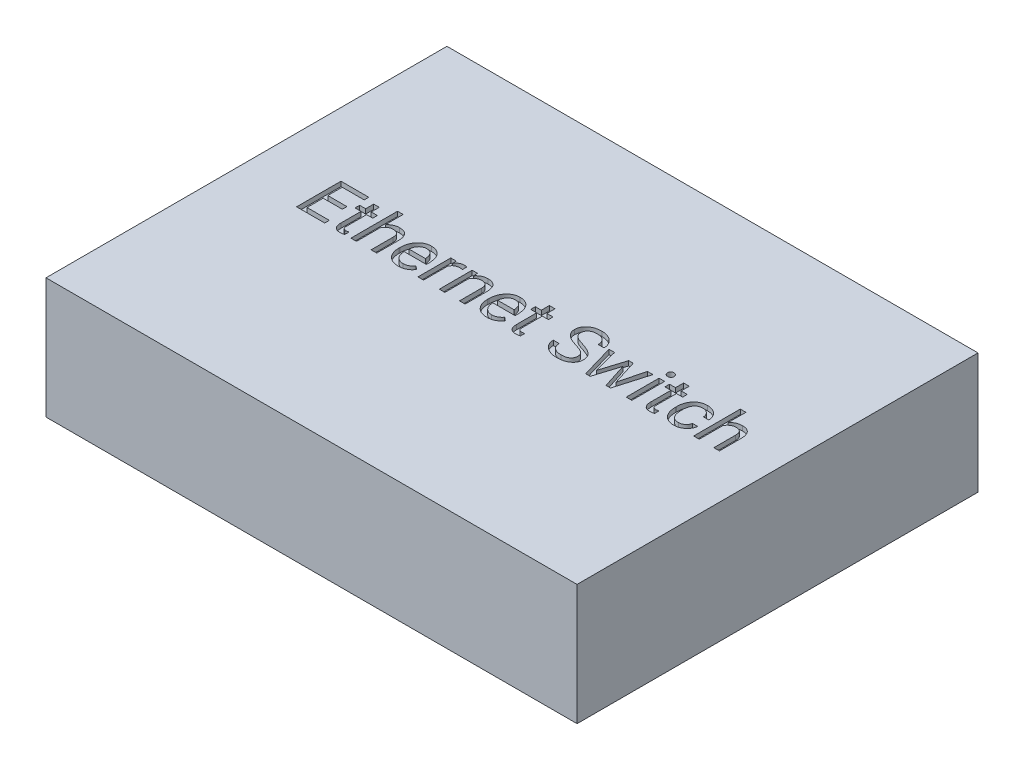
from build123d import *

# Parameters (mm, degrees)
SKETCH1_W           = 114.046
SKETCH1_H           = 86.106
BOSS_EXTRUDE1_DEPTH = 12.954
SKETCH2_W           = 1.206087662
SKETCH2_H           = 7.050974026
CUT_EXTRUDE1_DEPTH  = 1


with BuildPart() as part:
    # Sketch1 → Boss-Extrude1 (new, symmetric)
    with BuildSketch(Plane(origin=(0, 0, 0), x_dir=(1, 0, 0), z_dir=(0, 1, 0))):
        with Locations((57.023, 43.053)):
            Rectangle(SKETCH1_W, SKETCH1_H)
    extrude(amount=BOSS_EXTRUDE1_DEPTH, both=True)

    # Sketch2 → Cut-Extrude1 (cut)
    # profile 1 of 15: a face of its own
    with BuildSketch(Plane(origin=(0, 12.954, 0), x_dir=(1, 0, 0), z_dir=(0, 1, 0))):
        with BuildLine():
            add(Edge.make_bspline(
                [(84.393738457, 49.07515614), (84.395988724, 49.121740429), (84.400361707, 49.212268465), (84.433798421, 49.342484863), (84.490920099, 49.460792959), (84.570685999, 49.565566641), (84.67164016, 49.654939388), (84.798377615, 49.717091756), (84.944798541, 49.755933377), (85.105624155, 49.764005142), (85.266065985, 49.756460845), (85.412535753, 49.716169796), (85.540179197, 49.655699643), (85.640988395, 49.564830263), (85.723956021, 49.461189062), (85.779196726, 49.340555973), (85.815320997, 49.210744244), (85.825656935, 49.073838563), (85.814999137, 48.937099075), (85.780081634, 48.808668286), (85.723142246, 48.690751535), (85.64160492, 48.589102027), (85.539232867, 48.502528449), (85.412460966, 48.44355678), (85.26574728, 48.40611134), (85.105626878, 48.397554977), (84.945101759, 48.406621943), (84.798485283, 48.442663112), (84.672523827, 48.50325127), (84.570234336, 48.588438838), (84.4904732, 48.691827656), (84.434248468, 48.809247128), (84.400107229, 48.938610746), (84.395912159, 49.028552342), (84.393738457, 49.07515614)],
                knots=[0, 0, 0, 0, 1.003253555, 1.949639571, 2.87501048, 3.816493968, 4.771398848, 5.752595909, 6.830435126, 8.01367739, 9.210771534, 10.275199678, 11.268797055, 12.223701935, 13.173646762, 14.111539333, 15.061484161, 16.064737715, 17.054153962, 18.004098789, 18.916987501, 19.856010126, 20.792977095, 21.780442597, 22.841332467, 24.03842661, 25.221668875, 26.296013986, 27.271001189, 28.207968158, 29.138430125, 30.063801034, 30.996746445, 32, 32, 32, 32], degree=3))
        make_face()
    # profile 2 of 15: a face of its own
    with BuildSketch(Plane(origin=(0, 12.954, 0), x_dir=(1, 0, 0), z_dir=(0, 1, 0))):
        Polygon((19.075587077, 44.565857236), (14.958653229, 44.565857236), (14.958653229, 41.102220872), (19.740481557, 41.102220872), (19.740481557, 40.112610483), (13.70617758, 40.112610483), (13.70617758, 49.637610483), (19.676698075, 49.637610483), (19.676698075, 48.648000093), (14.958653229, 48.648000093), (14.958653229, 45.555467626), (19.075587077, 45.555467626), align=None)
    # profile 3 of 15: a face of its own
    with BuildSketch(Plane(origin=(0, 12.954, 0), x_dir=(1, 0, 0), z_dir=(0, 1, 0))):
        with BuildLine():
            Line((22.6841859, 48.89540269), (22.6841859, 47.163584509))
            Line((22.6841859, 47.163584509), (24.000445031, 47.163584509))
            Line((24.000445031, 47.163584509), (24.000445031, 46.173974119))
            Line((24.000445031, 46.173974119), (22.6841859, 46.173974119))
            Line((22.6841859, 46.173974119), (22.6841859, 41.821234671))
            add(Edge.make_bspline(
                [(22.6841859, 41.821234671), (22.68627404, 41.755360583), (22.690213925, 41.631069941), (22.722657013, 41.457550969), (22.77557331, 41.308820061), (22.854843152, 41.185400753), (22.963228171, 41.089025748), (23.102844259, 41.022426812), (23.271815776, 40.985564598), (23.393991216, 40.980972478), (23.45925185, 40.978519574)],
                knots=[0, 0, 0, 0, 1.194179343, 2.253166964, 3.188819159, 4.041361455, 4.885773766, 5.78479529, 6.816737128, 8, 8, 8, 8], degree=3))
            add(Edge.make_bspline(
                [(23.45925185, 40.978519574), (23.497284534, 40.9801046), (23.579966739, 40.983550413), (23.714358116, 40.997214254), (23.86746733, 41.023459183), (23.976009657, 41.044648309), (24.033303189, 41.055832885)],
                knots=[0, 0, 0, 0, 0.787449865, 1.711898398, 2.792236841, 4, 4, 4, 4], degree=3))
            Line((24.033303189, 41.055832885), (24.033303189, 40.114543315))
            add(Edge.make_bspline(
                [(24.033303189, 40.114543315), (23.954882378, 40.095672023), (23.799521243, 40.058285703), (23.566067845, 40.017380525), (23.335407413, 39.99361694), (23.182908819, 39.99046719), (23.107476281, 39.988909184)],
                knots=[0, 0, 0, 0, 1.033085524, 2.046667695, 3.033795592, 4, 4, 4, 4], degree=3))
            add(Edge.make_bspline(
                [(23.107476281, 39.988909184), (23.042314742, 39.990235056), (22.915424007, 39.992816961), (22.731354767, 40.017408187), (22.558314945, 40.052019039), (22.399425611, 40.107261752), (22.252016041, 40.17533966), (22.11715207, 40.258400311), (21.992825884, 40.355407811), (21.885326847, 40.471243954), (21.787621229, 40.598762886), (21.705290049, 40.741166885), (21.633166638, 40.894067772), (21.574915616, 41.059850796), (21.531287973, 41.238703617), (21.498402199, 41.4297977), (21.478822555, 41.633984069), (21.477068766, 41.774158768), (21.476165405, 41.846361497)],
                knots=[0, 0, 0, 0, 1.108571827, 2.158750336, 3.156840449, 4.107148202, 5.014858842, 5.91585275, 6.797958628, 7.690098004, 8.598206094, 9.527394683, 10.484135866, 11.472720431, 12.512770955, 13.614431317, 14.77121499, 16, 16, 16, 16], degree=3))
            Line((21.476165405, 41.846361497), (21.476165405, 46.173974119))
            Line((21.476165405, 46.173974119), (20.190831598, 46.173974119))
            Line((20.190831598, 46.173974119), (20.190831598, 47.163584509))
            Line((20.190831598, 47.163584509), (21.476165405, 47.163584509))
            Line((21.476165405, 47.163584509), (21.476165405, 48.89540269))
            Line((21.476165405, 48.89540269), (22.6841859, 48.89540269))
        make_face()
    # profile 4 of 15: a face of its own
    with BuildSketch(Plane(origin=(0, 12.954, 0), x_dir=(1, 0, 0), z_dir=(0, 1, 0))):
        with BuildLine():
            add(Edge.make_bspline(
                [(26.569179812, 46.303473916), (26.637266202, 46.381552348), (26.771045186, 46.534964112), (26.994242002, 46.737462888), (27.234859891, 46.90720166), (27.489474463, 47.046734104), (27.760426798, 47.154107596), (28.045590078, 47.231292682), (28.346446779, 47.278760581), (28.552092192, 47.284412471), (28.656639228, 47.287285807)],
                knots=[0, 0, 0, 0, 1.039536542, 2.042524824, 3.017095615, 3.989732349, 4.950704766, 5.936184754, 6.950787365, 8, 8, 8, 8], degree=3))
            add(Edge.make_bspline(
                [(28.656639228, 47.287285807), (28.746902767, 47.285449189), (28.922765086, 47.281870867), (29.177927682, 47.253680527), (29.414929915, 47.202476573), (29.635881191, 47.135746675), (29.83899786, 47.046938531), (30.025383708, 46.937439961), (30.193374168, 46.808011662), (30.344537648, 46.65867744), (30.477803063, 46.490701762), (30.592602149, 46.301928675), (30.69168797, 46.095139672), (30.769984111, 45.8663383), (30.833413859, 45.619505221), (30.88018299, 45.352705528), (30.906061713, 45.066316591), (30.91142411, 44.868716431), (30.914187929, 44.766871846)],
                knots=[0, 0, 0, 0, 1.11894567, 2.180064983, 3.176408189, 4.121284808, 5.036911353, 5.917734688, 6.794819938, 7.658971414, 8.545893982, 9.445919302, 10.392684596, 11.382926046, 12.438741236, 13.549675942, 14.737084854, 16, 16, 16, 16], degree=3))
            Line((30.914187929, 44.766871846), (30.914187929, 40.112610483))
            Line((30.914187929, 40.112610483), (29.706167434, 40.112610483))
            Line((29.706167434, 40.112610483), (29.706167434, 44.799730004))
            add(Edge.make_bspline(
                [(29.706167434, 44.799730004), (29.705111693, 44.861616427), (29.703072681, 44.98114119), (29.685828782, 45.154429803), (29.655867875, 45.314118785), (29.621294843, 45.463397847), (29.569170836, 45.598065209), (29.512727636, 45.723136415), (29.442787733, 45.834646539), (29.359628056, 45.931460503), (29.269402597, 46.020774755), (29.162702926, 46.093470757), (29.047035165, 46.157246784), (28.91929947, 46.211277787), (28.778254926, 46.247391798), (28.626752179, 46.277303222), (28.463107985, 46.294617935), (28.350002752, 46.296631144), (28.29133383, 46.297675418)],
                knots=[0, 0, 0, 0, 1.252582418, 2.419183561, 3.51915157, 4.540799327, 5.51463237, 6.436427351, 7.315632186, 8.167224478, 9.015815731, 9.87694107, 10.769965296, 11.68787746, 12.674980604, 13.710846149, 14.812590855, 16, 16, 16, 16], degree=3))
            add(Edge.make_bspline(
                [(28.29133383, 46.297675418), (28.196277139, 46.294331714), (28.009970617, 46.287778216), (27.740106224, 46.225206799), (27.487512365, 46.126310773), (27.255846554, 45.988148794), (27.046709577, 45.81855701), (26.859915991, 45.624180049), (26.696937307, 45.4043455), (26.612156417, 45.241689485), (26.569179812, 45.159236903)],
                knots=[0, 0, 0, 0, 1.044429403, 2.047031152, 3.030327181, 4.018694736, 5.001760782, 5.984392266, 6.978260582, 8, 8, 8, 8], degree=3))
            Line((26.569179812, 45.159236903), (26.569179812, 40.112610483))
            Line((26.569179812, 40.112610483), (25.36309215, 40.112610483))
            Line((25.36309215, 40.112610483), (25.36309215, 50.132415677))
            Line((25.36309215, 50.132415677), (26.569179812, 50.132415677))
            Line((26.569179812, 50.132415677), (26.569179812, 46.303473916))
        make_face()
    # profile 5 of 15: a face of its own
    with BuildSketch(Plane(origin=(0, 12.954, 0), x_dir=(1, 0, 0), z_dir=(0, 1, 0))):
        with BuildLine():
            add(Edge.make_bspline(
                [(35.607105949, 39.988909184), (35.490371734, 39.992122999), (35.261273976, 39.9984303), (34.925752241, 40.040760355), (34.606285582, 40.114096294), (34.304345584, 40.219292497), (34.018165026, 40.350822257), (33.749157983, 40.512030007), (33.499119498, 40.705622395), (33.26566094, 40.924773826), (33.055416882, 41.169532548), (32.872890249, 41.436356918), (32.717091624, 41.722451839), (32.589901716, 42.028253975), (32.490365629, 42.353803057), (32.422308385, 42.699676737), (32.378367214, 43.064844767), (32.37384874, 43.315183156), (32.371543854, 43.442881384)],
                knots=[0, 0, 0, 0, 1.051225119, 2.063091096, 3.039863284, 3.997702364, 4.937463199, 5.871835042, 6.815332018, 7.779913259, 8.750981872, 9.715004522, 10.6860558, 11.679572897, 12.692718992, 13.746423136, 14.850444908, 16, 16, 16, 16], degree=3))
            Line((32.371543854, 43.442881384), (32.371543854, 43.663224322))
            add(Edge.make_bspline(
                [(32.371543854, 43.663224322), (32.372436703, 43.749600315), (32.37419809, 43.920000415), (32.394780372, 44.171511771), (32.424815918, 44.416223759), (32.469645354, 44.653554963), (32.525956632, 44.884465908), (32.5929037, 45.108877647), (32.674242615, 45.325870134), (32.769347882, 45.534662782), (32.874806734, 45.733937698), (32.989377379, 45.923733712), (33.115646367, 46.101225663), (33.249938694, 46.269511653), (33.395803938, 46.425510863), (33.553294622, 46.567429254), (33.717470408, 46.702637066), (33.892726375, 46.822946601), (34.074254814, 46.931239544), (34.260248972, 47.026044936), (34.450165964, 47.108379844), (34.644421462, 47.173187068), (34.842086935, 47.224080471), (35.042864503, 47.261028904), (35.248425404, 47.282375134), (35.386715287, 47.285641284), (35.456344991, 47.287285807)],
                knots=[0, 0, 0, 0, 1.170389505, 2.308911091, 3.417986088, 4.510645856, 5.58017196, 6.638193788, 7.682688568, 8.718275774, 9.745583472, 10.73697058, 11.720597728, 12.695660602, 13.65320595, 14.611228956, 15.567220266, 16.533682422, 17.489115256, 18.430275997, 19.361295633, 20.291864719, 21.202556407, 22.125721625, 23.056290712, 24, 24, 24, 24], degree=3))
            add(Edge.make_bspline(
                [(35.456344991, 47.287285807), (35.567957701, 47.285023833), (35.785598283, 47.280613069), (36.102008556, 47.236568236), (36.40031307, 47.167911356), (36.679153276, 47.069338231), (36.939396011, 46.942534996), (37.179735391, 46.787754755), (37.400514429, 46.603541315), (37.601080559, 46.392496935), (37.782184124, 46.156225927), (37.936233512, 45.893083768), (38.068515751, 45.607922605), (38.174341052, 45.297992855), (38.257233146, 44.964267417), (38.315911586, 44.60617468), (38.353898775, 44.223919435), (38.357569651, 43.960976065), (38.359459845, 43.825582276)],
                knots=[0, 0, 0, 0, 1.043722712, 2.035219983, 2.982713475, 3.903600427, 4.795969756, 5.68552487, 6.571580403, 7.479752251, 8.404498235, 9.350456392, 10.326811463, 11.341010182, 12.409761646, 13.540517269, 14.733572618, 16, 16, 16, 16], degree=3))
            Line((38.359459845, 43.825582276), (38.359459845, 43.328844249))
            Line((38.359459845, 43.328844249), (33.577631517, 43.328844249))
            add(Edge.make_bspline(
                [(33.577631517, 43.328844249), (33.581442473, 43.24304779), (33.588889949, 43.075381981), (33.622496254, 42.830465636), (33.672421088, 42.597687357), (33.739791408, 42.376955342), (33.824870146, 42.169041152), (33.928261899, 41.974476716), (34.047936127, 41.792040095), (34.1854903, 41.624489061), (34.334886537, 41.472266987), (34.496221832, 41.338985689), (34.669237794, 41.229450271), (34.850662983, 41.136978166), (35.041932468, 41.065513382), (35.243623125, 41.015472241), (35.454661658, 40.983295223), (35.599255015, 40.980129999), (35.672822264, 40.978519574)],
                knots=[0, 0, 0, 0, 1.170963297, 2.288328803, 3.36740092, 4.415427927, 5.432183575, 6.42682151, 7.416438249, 8.403319616, 9.37898494, 10.321963152, 11.250788358, 12.166549739, 13.095374945, 14.028969237, 14.997164786, 16, 16, 16, 16], degree=3))
            add(Edge.make_bspline(
                [(35.672822264, 40.978519574), (35.775464773, 40.981113263), (35.973608591, 40.98612019), (36.258386953, 41.035016505), (36.518569344, 41.1162255), (36.755114406, 41.230012174), (36.971342179, 41.372353857), (37.173612874, 41.534382009), (37.363461036, 41.716890334), (37.475518762, 41.852924127), (37.53220741, 41.921741976)],
                knots=[0, 0, 0, 0, 1.136012797, 2.192989183, 3.18823502, 4.145723679, 5.089823975, 6.04933131, 7.013180329, 8, 8, 8, 8], degree=3))
            Line((37.53220741, 41.921741976), (38.268616703, 41.34962347))
            add(Edge.make_bspline(
                [(38.268616703, 41.34962347), (38.192705828, 41.241193859), (38.04379167, 41.028487785), (37.777296557, 40.749841915), (37.483553483, 40.513855009), (37.161595234, 40.320892916), (36.811862139, 40.170715587), (36.434222669, 40.065437283), (36.029434905, 40.000202695), (35.75039007, 39.992740749), (35.607105949, 39.988909184)],
                knots=[0, 0, 0, 0, 1.014704253, 1.990542579, 2.947365425, 3.898858026, 4.862403721, 5.859509066, 6.90089934, 8, 8, 8, 8], degree=3))
        make_face()
        with BuildLine():
            add(Edge.make_bspline(
                [(35.456344991, 46.297675418), (35.396326335, 46.29645875), (35.278952509, 46.294079407), (35.106839203, 46.267439463), (34.941896216, 46.226803962), (34.782903497, 46.171900905), (34.633043129, 46.096350715), (34.488878379, 46.00796779), (34.353810787, 45.900475538), (34.225636698, 45.778820933), (34.108821195, 45.641474279), (34.001004675, 45.492463416), (33.909124497, 45.32798298), (33.824731803, 45.152560452), (33.756629295, 44.961429378), (33.695940545, 44.759274632), (33.649698406, 44.54327722), (33.628886216, 44.394629292), (33.618221005, 44.318454638)],
                knots=[0, 0, 0, 0, 0.965700087, 1.888544676, 2.796872033, 3.699195918, 4.589995704, 5.493928382, 6.417472449, 7.364036721, 8.335127011, 9.316799301, 10.320480783, 11.364630344, 12.447737028, 13.5835194, 14.761674146, 16, 16, 16, 16], degree=3))
            Line((33.618221005, 44.318454638), (37.153372182, 44.318454638))
            Line((37.153372182, 44.318454638), (37.153372182, 44.407364947))
            add(Edge.make_bspline(
                [(37.153372182, 44.407364947), (37.147786614, 44.480250775), (37.136874069, 44.62264806), (37.106548955, 44.8295911), (37.06143774, 45.023778498), (37.006473196, 45.205135887), (36.937845505, 45.373968697), (36.85719385, 45.530046704), (36.764184403, 45.673949081), (36.659348795, 45.804261254), (36.543445158, 45.920379378), (36.417102448, 46.021632807), (36.280918436, 46.107233469), (36.134984271, 46.177147125), (35.979367828, 46.231405671), (35.813534665, 46.269999168), (35.638056952, 46.293384138), (35.517623782, 46.296228268), (35.456344991, 46.297675418)],
                knots=[0, 0, 0, 0, 1.231488959, 2.405964106, 3.519878164, 4.587773015, 5.59571827, 6.586208607, 7.543728754, 8.477887434, 9.399024737, 10.302660484, 11.200211513, 12.103325454, 13.023438702, 13.971372583, 14.967794054, 16, 16, 16, 16], degree=3))
        make_face(mode=Mode.SUBTRACT)
    # profile 6 of 15: a face of its own
    with BuildSketch(Plane(origin=(0, 12.954, 0), x_dir=(1, 0, 0), z_dir=(0, 1, 0))):
        with BuildLine():
            add(Edge.make_bspline(
                [(43.181877661, 46.253220263), (43.086659658, 46.265945993), (42.889742539, 46.292263643), (42.691092228, 46.295832341), (42.588497994, 46.297675418)],
                knots=[0, 0, 0, 0, 0.967087096, 2, 2, 2, 2], degree=3))
            add(Edge.make_bspline(
                [(42.588497994, 46.297675418), (42.492880397, 46.295348664), (42.308570696, 46.290863681), (42.044702115, 46.238483759), (41.804686481, 46.158182091), (41.587292265, 46.045037567), (41.396615451, 45.895462575), (41.2281327, 45.715596588), (41.085174399, 45.501703886), (41.013510501, 45.342124091), (40.976515445, 45.259744208)],
                knots=[0, 0, 0, 0, 1.117396154, 2.153860347, 3.133723222, 4.071226581, 5.006180228, 5.955611437, 6.944625228, 8, 8, 8, 8], degree=3))
            Line((40.976515445, 45.259744208), (40.976515445, 40.112610483))
            Line((40.976515445, 40.112610483), (39.770427783, 40.112610483))
            Line((39.770427783, 40.112610483), (39.770427783, 47.163584509))
            Line((39.770427783, 47.163584509), (40.943657288, 47.163584509))
            Line((40.943657288, 47.163584509), (40.962985616, 46.344063405))
            add(Edge.make_bspline(
                [(40.962985616, 46.344063405), (41.013565146, 46.41870515), (41.112562447, 46.564798468), (41.284489478, 46.758540477), (41.473313774, 46.921692603), (41.676577877, 47.056692623), (41.898182409, 47.158767593), (42.133095097, 47.236123727), (42.385377467, 47.277703389), (42.558079813, 47.284041463), (42.646482978, 47.287285807)],
                knots=[0, 0, 0, 0, 1.069262689, 2.092825304, 3.063142347, 4.023801543, 4.978110818, 5.950143453, 6.950716006, 8, 8, 8, 8], degree=3))
            add(Edge.make_bspline(
                [(42.646482978, 47.287285807), (42.701971193, 47.287156541), (42.805470302, 47.286915427), (42.949792333, 47.2695661), (43.074806639, 47.25013448), (43.148030089, 47.222668607), (43.181877661, 47.209972496)],
                knots=[0, 0, 0, 0, 1.222168938, 2.279644317, 3.204764829, 4, 4, 4, 4], degree=3))
            Line((43.181877661, 47.209972496), (43.181877661, 46.253220263))
        make_face()
    # profile 7 of 15: a face of its own
    with BuildSketch(Plane(origin=(0, 12.954, 0), x_dir=(1, 0, 0), z_dir=(0, 1, 0))):
        with BuildLine():
            Line((45.487747182, 47.163584509), (45.526403838, 46.272548591))
            add(Edge.make_bspline(
                [(45.526403838, 46.272548591), (45.594922769, 46.353394927), (45.729543556, 46.512235661), (45.9571971, 46.719124367), (46.199056118, 46.895757445), (46.457237245, 47.039633471), (46.732193994, 47.150264391), (47.021505035, 47.228928007), (47.326032769, 47.279545867), (47.534411377, 47.284667774), (47.640922913, 47.287285807)],
                knots=[0, 0, 0, 0, 1.045030138, 2.05319576, 3.027464063, 3.995257506, 4.962319553, 5.944976367, 6.949586405, 8, 8, 8, 8], degree=3))
            add(Edge.make_bspline(
                [(47.640922913, 47.287285807), (47.731186452, 47.285449189), (47.907048771, 47.281870867), (48.162211367, 47.253680527), (48.3992136, 47.202476573), (48.620164876, 47.135746675), (48.823281545, 47.046938531), (49.009667393, 46.937439961), (49.177657853, 46.808011662), (49.328821333, 46.65867744), (49.462086748, 46.490701762), (49.576885834, 46.301928675), (49.675971655, 46.095139672), (49.754267796, 45.8663383), (49.817697544, 45.619505221), (49.864466675, 45.352705528), (49.890345398, 45.066316591), (49.895707795, 44.868716431), (49.898471614, 44.766871846)],
                knots=[0, 0, 0, 0, 1.11894567, 2.180064983, 3.176408189, 4.121284808, 5.036911353, 5.917734688, 6.794819938, 7.658971414, 8.545893982, 9.445919302, 10.392684596, 11.382926046, 12.438741236, 13.549675942, 14.737084854, 16, 16, 16, 16], degree=3))
            Line((49.898471614, 44.766871846), (49.898471614, 40.112610483))
            Line((49.898471614, 40.112610483), (48.690451119, 40.112610483))
            Line((48.690451119, 40.112610483), (48.690451119, 44.799730004))
            add(Edge.make_bspline(
                [(48.690451119, 44.799730004), (48.689395378, 44.861616427), (48.687356367, 44.98114119), (48.670112467, 45.154429803), (48.64015156, 45.314118785), (48.605578528, 45.463397847), (48.553454522, 45.598065209), (48.497011321, 45.723136415), (48.427071418, 45.834646539), (48.343911741, 45.931460503), (48.253686283, 46.020774755), (48.146986611, 46.093470757), (48.03131885, 46.157246784), (47.903583155, 46.211277787), (47.762538611, 46.247391798), (47.611035864, 46.277303222), (47.447391671, 46.294617935), (47.334286437, 46.296631144), (47.275617515, 46.297675418)],
                knots=[0, 0, 0, 0, 1.252582418, 2.419183561, 3.51915157, 4.540799327, 5.51463237, 6.436427351, 7.315632186, 8.167224478, 9.015815731, 9.87694107, 10.769965296, 11.68787746, 12.674980604, 13.710846149, 14.812590855, 16, 16, 16, 16], degree=3))
            add(Edge.make_bspline(
                [(47.275617515, 46.297675418), (47.180560824, 46.294331714), (46.994254302, 46.287778216), (46.724389909, 46.225206799), (46.47179605, 46.126310773), (46.240130239, 45.988148794), (46.030993262, 45.81855701), (45.844199676, 45.624180049), (45.681220992, 45.4043455), (45.596440102, 45.241689485), (45.553463497, 45.159236903)],
                knots=[0, 0, 0, 0, 1.044429403, 2.047031152, 3.030327181, 4.018694736, 5.001760782, 5.984392266, 6.978260582, 8, 8, 8, 8], degree=3))
            Line((45.553463497, 45.159236903), (45.553463497, 40.112610483))
            Line((45.553463497, 40.112610483), (44.347375835, 40.112610483))
            Line((44.347375835, 40.112610483), (44.347375835, 47.163584509))
            Line((44.347375835, 47.163584509), (45.487747182, 47.163584509))
        make_face()
    # profile 8 of 15: a face of its own
    with BuildSketch(Plane(origin=(0, 12.954, 0), x_dir=(1, 0, 0), z_dir=(0, 1, 0))):
        with BuildLine():
            add(Edge.make_bspline(
                [(54.657105949, 39.988909184), (54.540371734, 39.992122999), (54.311273976, 39.9984303), (53.975752241, 40.040760355), (53.656285582, 40.114096294), (53.354345584, 40.219292497), (53.068165026, 40.350822257), (52.799157983, 40.512030007), (52.549119498, 40.705622395), (52.31566094, 40.924773826), (52.105416882, 41.169532548), (51.922890249, 41.436356918), (51.767091624, 41.722451839), (51.639901716, 42.028253975), (51.540365629, 42.353803057), (51.472308385, 42.699676737), (51.428367214, 43.064844767), (51.42384874, 43.315183156), (51.421543854, 43.442881384)],
                knots=[0, 0, 0, 0, 1.051225119, 2.063091096, 3.039863284, 3.997702364, 4.937463199, 5.871835042, 6.815332018, 7.779913259, 8.750981872, 9.715004522, 10.6860558, 11.679572897, 12.692718992, 13.746423136, 14.850444908, 16, 16, 16, 16], degree=3))
            Line((51.421543854, 43.442881384), (51.421543854, 43.663224322))
            add(Edge.make_bspline(
                [(51.421543854, 43.663224322), (51.422436703, 43.749600315), (51.42419809, 43.920000415), (51.444780372, 44.171511771), (51.474815918, 44.416223759), (51.519645354, 44.653554963), (51.575956632, 44.884465908), (51.6429037, 45.108877647), (51.724242615, 45.325870134), (51.819347882, 45.534662782), (51.924806734, 45.733937698), (52.039377379, 45.923733712), (52.165646367, 46.101225663), (52.299938694, 46.269511653), (52.445803938, 46.425510863), (52.603294622, 46.567429254), (52.767470408, 46.702637066), (52.942726375, 46.822946601), (53.124254814, 46.931239544), (53.310248972, 47.026044936), (53.500165964, 47.108379844), (53.694421462, 47.173187068), (53.892086935, 47.224080471), (54.092864503, 47.261028904), (54.298425404, 47.282375134), (54.436715287, 47.285641284), (54.506344991, 47.287285807)],
                knots=[0, 0, 0, 0, 1.170389505, 2.308911091, 3.417986088, 4.510645856, 5.58017196, 6.638193788, 7.682688568, 8.718275774, 9.745583472, 10.73697058, 11.720597728, 12.695660602, 13.65320595, 14.611228956, 15.567220266, 16.533682422, 17.489115256, 18.430275997, 19.361295633, 20.291864719, 21.202556407, 22.125721625, 23.056290712, 24, 24, 24, 24], degree=3))
            add(Edge.make_bspline(
                [(54.506344991, 47.287285807), (54.617957701, 47.285023833), (54.835598283, 47.280613069), (55.152008556, 47.236568236), (55.45031307, 47.167911356), (55.729153276, 47.069338231), (55.989396011, 46.942534996), (56.229735391, 46.787754755), (56.450514429, 46.603541315), (56.651080559, 46.392496935), (56.832184124, 46.156225927), (56.986233512, 45.893083768), (57.118515751, 45.607922605), (57.224341052, 45.297992855), (57.307233146, 44.964267417), (57.365911586, 44.60617468), (57.403898775, 44.223919435), (57.407569651, 43.960976065), (57.409459845, 43.825582276)],
                knots=[0, 0, 0, 0, 1.043722712, 2.035219983, 2.982713475, 3.903600427, 4.795969756, 5.68552487, 6.571580403, 7.479752251, 8.404498235, 9.350456392, 10.326811463, 11.341010182, 12.409761646, 13.540517269, 14.733572618, 16, 16, 16, 16], degree=3))
            Line((57.409459845, 43.825582276), (57.409459845, 43.328844249))
            Line((57.409459845, 43.328844249), (52.627631517, 43.328844249))
            add(Edge.make_bspline(
                [(52.627631517, 43.328844249), (52.631442473, 43.24304779), (52.638889949, 43.075381981), (52.672496254, 42.830465636), (52.722421088, 42.597687357), (52.789791408, 42.376955342), (52.874870146, 42.169041152), (52.978261899, 41.974476716), (53.097936127, 41.792040095), (53.2354903, 41.624489061), (53.384886537, 41.472266987), (53.546221832, 41.338985689), (53.719237794, 41.229450271), (53.900662983, 41.136978166), (54.091932468, 41.065513382), (54.293623125, 41.015472241), (54.504661658, 40.983295223), (54.649255015, 40.980129999), (54.722822264, 40.978519574)],
                knots=[0, 0, 0, 0, 1.170963297, 2.288328803, 3.36740092, 4.415427927, 5.432183575, 6.42682151, 7.416438249, 8.403319616, 9.37898494, 10.321963152, 11.250788358, 12.166549739, 13.095374945, 14.028969237, 14.997164786, 16, 16, 16, 16], degree=3))
            add(Edge.make_bspline(
                [(54.722822264, 40.978519574), (54.825464773, 40.981113263), (55.023608591, 40.98612019), (55.308386953, 41.035016505), (55.568569344, 41.1162255), (55.805114406, 41.230012174), (56.021342179, 41.372353857), (56.223612874, 41.534382009), (56.413461036, 41.716890334), (56.525518762, 41.852924127), (56.58220741, 41.921741976)],
                knots=[0, 0, 0, 0, 1.136012797, 2.192989183, 3.18823502, 4.145723679, 5.089823975, 6.04933131, 7.013180329, 8, 8, 8, 8], degree=3))
            Line((56.58220741, 41.921741976), (57.318616703, 41.34962347))
            add(Edge.make_bspline(
                [(57.318616703, 41.34962347), (57.242705828, 41.241193859), (57.09379167, 41.028487785), (56.827296557, 40.749841915), (56.533553483, 40.513855009), (56.211595234, 40.320892916), (55.861862139, 40.170715587), (55.484222669, 40.065437283), (55.079434905, 40.000202695), (54.80039007, 39.992740749), (54.657105949, 39.988909184)],
                knots=[0, 0, 0, 0, 1.014704253, 1.990542579, 2.947365425, 3.898858026, 4.862403721, 5.859509066, 6.90089934, 8, 8, 8, 8], degree=3))
        make_face()
        with BuildLine():
            add(Edge.make_bspline(
                [(54.506344991, 46.297675418), (54.446326335, 46.29645875), (54.328952509, 46.294079407), (54.156839203, 46.267439463), (53.991896216, 46.226803962), (53.832903497, 46.171900905), (53.683043129, 46.096350715), (53.538878379, 46.00796779), (53.403810787, 45.900475538), (53.275636698, 45.778820933), (53.158821195, 45.641474279), (53.051004675, 45.492463416), (52.959124497, 45.32798298), (52.874731803, 45.152560452), (52.806629295, 44.961429378), (52.745940545, 44.759274632), (52.699698406, 44.54327722), (52.678886216, 44.394629292), (52.668221005, 44.318454638)],
                knots=[0, 0, 0, 0, 0.965700087, 1.888544676, 2.796872033, 3.699195918, 4.589995704, 5.493928382, 6.417472449, 7.364036721, 8.335127011, 9.316799301, 10.320480783, 11.364630344, 12.447737028, 13.5835194, 14.761674146, 16, 16, 16, 16], degree=3))
            Line((52.668221005, 44.318454638), (56.203372182, 44.318454638))
            Line((56.203372182, 44.318454638), (56.203372182, 44.407364947))
            add(Edge.make_bspline(
                [(56.203372182, 44.407364947), (56.197786614, 44.480250775), (56.186874069, 44.62264806), (56.156548955, 44.8295911), (56.11143774, 45.023778498), (56.056473196, 45.205135887), (55.987845505, 45.373968697), (55.90719385, 45.530046704), (55.814184403, 45.673949081), (55.709348795, 45.804261254), (55.593445158, 45.920379378), (55.467102448, 46.021632807), (55.330918436, 46.107233469), (55.184984271, 46.177147125), (55.029367828, 46.231405671), (54.863534665, 46.269999168), (54.688056952, 46.293384138), (54.567623782, 46.296228268), (54.506344991, 46.297675418)],
                knots=[0, 0, 0, 0, 1.231488959, 2.405964106, 3.519878164, 4.587773015, 5.59571827, 6.586208607, 7.543728754, 8.477887434, 9.399024737, 10.302660484, 11.200211513, 12.103325454, 13.023438702, 13.971372583, 14.967794054, 16, 16, 16, 16], degree=3))
        make_face(mode=Mode.SUBTRACT)
    # profile 9 of 15: a face of its own
    with BuildSketch(Plane(origin=(0, 12.954, 0), x_dir=(1, 0, 0), z_dir=(0, 1, 0))):
        with BuildLine():
            Line((60.413082004, 48.89540269), (60.413082004, 47.163584509))
            Line((60.413082004, 47.163584509), (61.729341135, 47.163584509))
            Line((61.729341135, 47.163584509), (61.729341135, 46.173974119))
            Line((61.729341135, 46.173974119), (60.413082004, 46.173974119))
            Line((60.413082004, 46.173974119), (60.413082004, 41.821234671))
            add(Edge.make_bspline(
                [(60.413082004, 41.821234671), (60.415170144, 41.755360583), (60.419110029, 41.631069941), (60.451553117, 41.457550969), (60.504469414, 41.308820061), (60.583739256, 41.185400753), (60.692124275, 41.089025748), (60.831740362, 41.022426812), (61.00071188, 40.985564598), (61.12288732, 40.980972478), (61.188147953, 40.978519574)],
                knots=[0, 0, 0, 0, 1.194179343, 2.253166964, 3.188819159, 4.041361455, 4.885773766, 5.78479529, 6.816737128, 8, 8, 8, 8], degree=3))
            add(Edge.make_bspline(
                [(61.188147953, 40.978519574), (61.226180638, 40.9801046), (61.308862843, 40.983550413), (61.44325422, 40.997214254), (61.596363434, 41.023459183), (61.70490576, 41.044648309), (61.762199293, 41.055832885)],
                knots=[0, 0, 0, 0, 0.787449865, 1.711898398, 2.792236841, 4, 4, 4, 4], degree=3))
            Line((61.762199293, 41.055832885), (61.762199293, 40.114543315))
            add(Edge.make_bspline(
                [(61.762199293, 40.114543315), (61.683778482, 40.095672023), (61.528417347, 40.058285703), (61.294963949, 40.017380525), (61.064303517, 39.99361694), (60.911804923, 39.99046719), (60.836372385, 39.988909184)],
                knots=[0, 0, 0, 0, 1.033085524, 2.046667695, 3.033795592, 4, 4, 4, 4], degree=3))
            add(Edge.make_bspline(
                [(60.836372385, 39.988909184), (60.771210846, 39.990235056), (60.644320111, 39.992816961), (60.460250871, 40.017408187), (60.287211049, 40.052019039), (60.128321715, 40.107261752), (59.980912145, 40.17533966), (59.846048173, 40.258400311), (59.721721988, 40.355407811), (59.614222951, 40.471243954), (59.516517333, 40.598762886), (59.434186152, 40.741166885), (59.362062742, 40.894067772), (59.30381172, 41.059850796), (59.260184077, 41.238703617), (59.227298303, 41.4297977), (59.207718659, 41.633984069), (59.20596487, 41.774158768), (59.205061509, 41.846361497)],
                knots=[0, 0, 0, 0, 1.108571827, 2.158750336, 3.156840449, 4.107148202, 5.014858842, 5.91585275, 6.797958628, 7.690098004, 8.598206094, 9.527394683, 10.484135866, 11.472720431, 12.512770955, 13.614431317, 14.77121499, 16, 16, 16, 16], degree=3))
            Line((59.205061509, 41.846361497), (59.205061509, 46.173974119))
            Line((59.205061509, 46.173974119), (57.919727702, 46.173974119))
            Line((57.919727702, 46.173974119), (57.919727702, 47.163584509))
            Line((57.919727702, 47.163584509), (59.205061509, 47.163584509))
            Line((59.205061509, 47.163584509), (59.205061509, 48.89540269))
            Line((59.205061509, 48.89540269), (60.413082004, 48.89540269))
        make_face()
    # profile 10 of 15: a face of its own
    with BuildSketch(Plane(origin=(0, 12.954, 0), x_dir=(1, 0, 0), z_dir=(0, 1, 0))):
        with BuildLine():
            add(Edge.make_bspline(
                [(69.445209642, 44.359044127), (69.315402563, 44.398023839), (69.063422249, 44.473690898), (68.701784958, 44.599688257), (68.366552428, 44.730464188), (68.058683202, 44.868433011), (67.780138817, 45.017051636), (67.525482996, 45.165659404), (67.29995843, 45.324912715), (67.101398288, 45.491715961), (66.92747963, 45.666664818), (66.77734717, 45.851904316), (66.649304757, 46.046320712), (66.546141756, 46.252323684), (66.464045533, 46.466293521), (66.408848363, 46.6917253), (66.372461633, 46.925948838), (66.368313091, 47.086130737), (66.366207004, 47.167450174)],
                knots=[0, 0, 0, 0, 1.442946769, 2.801035059, 4.076184517, 5.27352813, 6.39049285, 7.436375565, 8.410868717, 9.326094427, 10.194380871, 11.033255188, 11.860919352, 12.667768038, 13.481903433, 14.295489527, 15.134672321, 16, 16, 16, 16], degree=3))
            add(Edge.make_bspline(
                [(66.366207004, 47.167450174), (66.368539984, 47.259116758), (66.373133669, 47.43961009), (66.41735942, 47.703374191), (66.486798238, 47.955921199), (66.5859978, 48.195727044), (66.711958379, 48.424237758), (66.869563381, 48.637542981), (67.051064602, 48.84190387), (67.261822901, 49.029365005), (67.493201842, 49.201034235), (67.742746149, 49.353127271), (68.011969746, 49.477938859), (68.295886843, 49.583417111), (68.598009325, 49.661534449), (68.915710111, 49.719737178), (69.250491682, 49.75493212), (69.479271828, 49.759156806), (69.5959706, 49.761311781)],
                knots=[0, 0, 0, 0, 0.949123394, 1.868842894, 2.762934863, 3.658023202, 4.551541756, 5.459557031, 6.400379858, 7.378911715, 8.376299658, 9.382673259, 10.401021107, 11.446491644, 12.51683851, 13.629846909, 14.791005431, 16, 16, 16, 16], degree=3))
            add(Edge.make_bspline(
                [(69.5959706, 49.761311781), (69.754752701, 49.757239537), (70.065629522, 49.749266557), (70.517549531, 49.675717459), (70.943709212, 49.558464574), (71.339188387, 49.391987717), (71.70092982, 49.185868219), (72.024608273, 48.942949759), (72.302782331, 48.660495093), (72.535005844, 48.344929931), (72.718315954, 48.004076537), (72.854543203, 47.646111064), (72.933168695, 47.270069574), (72.943973571, 47.014465712), (72.949435494, 46.885256587)],
                knots=[0, 0, 0, 0, 1.157874431, 2.266982995, 3.331214249, 4.376333927, 5.389203378, 6.362366569, 7.319777149, 8.271341015, 9.211596087, 10.135441968, 11.0574559, 12, 12, 12, 12], degree=3))
            Line((72.949435494, 46.885256587), (71.689228514, 46.885256587))
            add(Edge.make_bspline(
                [(71.689228514, 46.885256587), (71.688242553, 46.956886037), (71.686325081, 47.096189189), (71.656977322, 47.298982635), (71.616333662, 47.490462936), (71.555123334, 47.67029398), (71.478780384, 47.838918966), (71.382475343, 47.994162307), (71.272066659, 48.13953187), (71.141947362, 48.269478655), (70.998705306, 48.388936936), (70.839206725, 48.491123587), (70.666196458, 48.57821663), (70.479460049, 48.650849297), (70.27733833, 48.703060321), (70.062589759, 48.744745148), (69.833549786, 48.767360849), (69.676550076, 48.770229215), (69.5959706, 48.771701392)],
                knots=[0, 0, 0, 0, 1.07482023, 2.090283341, 3.071654291, 4.011100091, 4.937699537, 5.845513922, 6.749400147, 7.673165639, 8.601178817, 9.545991787, 10.511053924, 11.506634652, 12.548856192, 13.642033026, 14.789782837, 16, 16, 16, 16], degree=3))
            add(Edge.make_bspline(
                [(69.5959706, 48.771701392), (69.521161343, 48.771050941), (69.375082289, 48.769780814), (69.162289764, 48.746428622), (68.961256218, 48.716335851), (68.773965896, 48.665668546), (68.598456794, 48.607766221), (68.435564525, 48.533568527), (68.287042333, 48.443758048), (68.149392496, 48.344158784), (68.026739695, 48.231915477), (67.921349736, 48.106827205), (67.833209834, 47.971181354), (67.757218516, 47.826500304), (67.702932416, 47.669708672), (67.661782009, 47.503530705), (67.635829699, 47.326755959), (67.633439963, 47.204909406), (67.632212483, 47.142323348)],
                knots=[0, 0, 0, 0, 1.241716152, 2.424682862, 3.552343531, 4.613889406, 5.642621132, 6.619453051, 7.579256212, 8.520993708, 9.437340774, 10.333406993, 11.229728757, 12.119897209, 13.040545374, 13.977467637, 14.961133287, 16, 16, 16, 16], degree=3))
            add(Edge.make_bspline(
                [(67.632212483, 47.142323348), (67.633644093, 47.09197551), (67.63646793, 46.99266488), (67.660517383, 46.846815513), (67.698677463, 46.707196589), (67.753999943, 46.573865336), (67.824060977, 46.446780478), (67.90666308, 46.323204756), (68.0096745, 46.20942473), (68.125551911, 46.098251232), (68.261802737, 45.99252132), (68.418533714, 45.8914891), (68.595631499, 45.790169709), (68.794398176, 45.692003306), (69.016071375, 45.598590076), (69.257492136, 45.502557137), (69.521990496, 45.413276203), (69.801974528, 45.326866937), (70.084410312, 45.240776566), (70.356789633, 45.152511941), (70.612650515, 45.061565164), (70.851985707, 44.968369606), (71.076381218, 44.876680823), (71.283908277, 44.78168216), (71.474984269, 44.684849406), (71.705798547, 44.559226534), (71.963934711, 44.392586022), (72.236220074, 44.173518334), (72.464311998, 43.936472069), (72.651636995, 43.682745176), (72.795303408, 43.407619135), (72.894676184, 43.110712417), (72.959788843, 42.791759994), (72.965713489, 42.570865341), (72.968763822, 42.45713666)],
                knots=[0, 0, 0, 0, 0.628745275, 1.240194059, 1.841759006, 2.4337678, 3.038984486, 3.653024503, 4.286135225, 4.952364021, 5.657715509, 6.436970535, 7.280712884, 8.205967425, 9.2048809, 10.28571615, 11.45169818, 12.691673175, 13.947023137, 15.140987995, 16.268972542, 17.339384487, 18.350004568, 19.297407454, 20.190260585, 21.026131742, 22.580248655, 24.022346325, 25.38312576, 26.67931735, 27.95036621, 29.243629624, 30.580869372, 32, 32, 32, 32], degree=3))
            add(Edge.make_bspline(
                [(72.968763822, 42.45713666), (72.966357251, 42.366134953), (72.961618994, 42.186963178), (72.918523377, 41.92524424), (72.846129231, 41.678697218), (72.749327014, 41.444549816), (72.620719483, 41.226359286), (72.464512196, 41.021165907), (72.279254936, 40.831571052), (72.06858142, 40.656440533), (71.835305821, 40.497072767), (71.578374568, 40.363342131), (71.305382889, 40.246515149), (71.013039912, 40.151507954), (70.701936296, 40.07869424), (70.371707024, 40.027678487), (70.023220699, 39.992992875), (69.78418863, 39.990292898), (69.661686915, 39.988909184)],
                knots=[0, 0, 0, 0, 0.942848476, 1.856358972, 2.739809959, 3.601872524, 4.47585665, 5.357462874, 6.269018184, 7.217338511, 8.193540532, 9.19141121, 10.214813886, 11.268707198, 12.373513087, 13.523113076, 14.730618449, 16, 16, 16, 16], degree=3))
            add(Edge.make_bspline(
                [(69.661686915, 39.988909184), (69.500972733, 39.993034916), (69.183067785, 40.001195929), (68.71571573, 40.076214377), (68.263701775, 40.19124907), (67.903079388, 40.327703473), (67.629534379, 40.459791014), (67.435177016, 40.565650423), (67.253718538, 40.68213763), (67.083307279, 40.805238401), (66.925596044, 40.937550327), (66.780104279, 41.078918371), (66.647026896, 41.229981486), (66.524824424, 41.38827976), (66.416332354, 41.554117259), (66.324339966, 41.726854972), (66.242890131, 41.903510618), (66.181397172, 42.087666968), (66.1265663, 42.275161987), (66.093580992, 42.469759375), (66.071249778, 42.669226257), (66.068174048, 42.804337742), (66.066617921, 42.87269571)],
                knots=[0, 0, 0, 0, 1.875437348, 3.709758582, 5.512552917, 7.31498618, 8.199939646, 9.058534596, 9.897491826, 10.716098565, 11.511740121, 12.299122756, 13.082578091, 13.860523725, 14.632590546, 15.39332156, 16.144205357, 16.900795953, 17.658283692, 18.422688591, 19.201978989, 20, 20, 20, 20], degree=3))
            Line((66.066617921, 42.87269571), (67.324892069, 42.87269571))
            add(Edge.make_bspline(
                [(67.324892069, 42.87269571), (67.326364443, 42.801032717), (67.329231154, 42.661504883), (67.362729515, 42.458602289), (67.408828848, 42.266528373), (67.479819765, 42.086160476), (67.57146029, 41.918478026), (67.679256848, 41.759589467), (67.811512647, 41.616413821), (67.959797698, 41.482983254), (68.125527443, 41.363412404), (68.30642089, 41.26146015), (68.499470191, 41.173203849), (68.706259684, 41.102696649), (68.926562994, 41.046165653), (69.15984238, 41.005956379), (69.406722769, 40.982778928), (69.575304034, 40.97996266), (69.661686915, 40.978519574)],
                knots=[0, 0, 0, 0, 1.013608767, 1.9734961, 2.904960116, 3.806182834, 4.708236215, 5.606545564, 6.517183783, 7.460367022, 8.42750932, 9.403985449, 10.396018541, 11.428821219, 12.493053148, 13.613359221, 14.777059221, 16, 16, 16, 16], degree=3))
            add(Edge.make_bspline(
                [(69.661686915, 40.978519574), (69.742258616, 40.979433222), (69.898498599, 40.981204917), (70.125218673, 41.000511052), (70.336832602, 41.03376975), (70.53495926, 41.077233667), (70.718395532, 41.135423246), (70.887972056, 41.20435872), (71.042200148, 41.2881366), (71.180716039, 41.384991084), (71.306266002, 41.490791352), (71.412077672, 41.609977323), (71.504386591, 41.736345639), (71.57982126, 41.871908923), (71.639198018, 42.017066239), (71.678375751, 42.172049779), (71.704443289, 42.335720567), (71.71084916, 42.505495718), (71.703715576, 42.674950126), (71.681338038, 42.837769406), (71.641217483, 42.99004956), (71.591051829, 43.134241101), (71.519230197, 43.265767863), (71.437071125, 43.389912011), (71.333872096, 43.499320935), (71.218448946, 43.604977231), (71.079646477, 43.700923564), (70.920625643, 43.799024659), (70.734419791, 43.891572401), (70.525105932, 43.986821962), (70.290804953, 44.081032374), (70.031528314, 44.175303647), (69.747627812, 44.270531926), (69.548508489, 44.328810467), (69.445209642, 44.359044127)],
                knots=[0, 0, 0, 0, 1.274731676, 2.47188592, 3.596566026, 4.662556682, 5.678218161, 6.638111757, 7.55508779, 8.448758248, 9.309066754, 10.146416499, 10.964173464, 11.781103867, 12.595166608, 13.438391695, 14.304959699, 15.213223308, 16.121486918, 16.98655437, 17.807482669, 18.610554914, 19.394967543, 20.172593202, 20.959189078, 21.767743109, 22.64474309, 23.623879884, 24.722710417, 25.931786394, 27.26268204, 28.717272089, 30.296990951, 32, 32, 32, 32], degree=3))
        make_face()
    # profile 11 of 15: a face of its own
    with BuildSketch(Plane(origin=(0, 12.954, 0), x_dir=(1, 0, 0), z_dir=(0, 1, 0))):
        Polygon((80.618916014, 41.774846684), (81.975764634, 47.163584509), (83.181852296, 47.163584509), (81.127251038, 40.112610483), (80.149237645, 40.112610483), (78.432882126, 45.456893153), (76.762914593, 40.112610483), (75.7849012, 40.112610483), (73.73609844, 47.163584509), (74.936387604, 47.163584509), (76.326094382, 41.885018153), (77.970935088, 47.163584509), (78.94121715, 47.163584509), align=None)
    # profile 12 of 15: a face of its own
    with BuildSketch(Plane(origin=(0, 12.954, 0), x_dir=(1, 0, 0), z_dir=(0, 1, 0))):
        with Locations((85.09535676, 43.638097496)):
            Rectangle(SKETCH2_W, SKETCH2_H)
    # profile 13 of 15: a face of its own
    with BuildSketch(Plane(origin=(0, 12.954, 0), x_dir=(1, 0, 0), z_dir=(0, 1, 0))):
        with BuildLine():
            Line((89.235484601, 48.89540269), (89.235484601, 47.163584509))
            Line((89.235484601, 47.163584509), (90.551743733, 47.163584509))
            Line((90.551743733, 47.163584509), (90.551743733, 46.173974119))
            Line((90.551743733, 46.173974119), (89.235484601, 46.173974119))
            Line((89.235484601, 46.173974119), (89.235484601, 41.821234671))
            add(Edge.make_bspline(
                [(89.235484601, 41.821234671), (89.237572742, 41.755360583), (89.241512626, 41.631069941), (89.273955715, 41.457550969), (89.326872011, 41.308820061), (89.406141853, 41.185400753), (89.514526873, 41.089025748), (89.65414296, 41.022426812), (89.823114477, 40.985564598), (89.945289917, 40.980972478), (90.010550551, 40.978519574)],
                knots=[0, 0, 0, 0, 1.194179343, 2.253166964, 3.188819159, 4.041361455, 4.885773766, 5.78479529, 6.816737128, 8, 8, 8, 8], degree=3))
            add(Edge.make_bspline(
                [(90.010550551, 40.978519574), (90.048583235, 40.9801046), (90.131265441, 40.983550413), (90.265656817, 40.997214254), (90.418766031, 41.023459183), (90.527308358, 41.044648309), (90.58460189, 41.055832885)],
                knots=[0, 0, 0, 0, 0.787449865, 1.711898398, 2.792236841, 4, 4, 4, 4], degree=3))
            Line((90.58460189, 41.055832885), (90.58460189, 40.114543315))
            add(Edge.make_bspline(
                [(90.58460189, 40.114543315), (90.506181079, 40.095672023), (90.350819944, 40.058285703), (90.117366547, 40.017380525), (89.886706114, 39.99361694), (89.734207521, 39.99046719), (89.658774983, 39.988909184)],
                knots=[0, 0, 0, 0, 1.033085524, 2.046667695, 3.033795592, 4, 4, 4, 4], degree=3))
            add(Edge.make_bspline(
                [(89.658774983, 39.988909184), (89.593613444, 39.990235056), (89.466722708, 39.992816961), (89.282653468, 40.017408187), (89.109613646, 40.052019039), (88.950724312, 40.107261752), (88.803314742, 40.17533966), (88.668450771, 40.258400311), (88.544124585, 40.355407811), (88.436625548, 40.471243954), (88.338919931, 40.598762886), (88.25658875, 40.741166885), (88.184465339, 40.894067772), (88.126214318, 41.059850796), (88.082586675, 41.238703617), (88.0497009, 41.4297977), (88.030121257, 41.633984069), (88.028367467, 41.774158768), (88.027464106, 41.846361497)],
                knots=[0, 0, 0, 0, 1.108571827, 2.158750336, 3.156840449, 4.107148202, 5.014858842, 5.91585275, 6.797958628, 7.690098004, 8.598206094, 9.527394683, 10.484135866, 11.472720431, 12.512770955, 13.614431317, 14.77121499, 16, 16, 16, 16], degree=3))
            Line((88.027464106, 41.846361497), (88.027464106, 46.173974119))
            Line((88.027464106, 46.173974119), (86.742130299, 46.173974119))
            Line((86.742130299, 46.173974119), (86.742130299, 47.163584509))
            Line((86.742130299, 47.163584509), (88.027464106, 47.163584509))
            Line((88.027464106, 47.163584509), (88.027464106, 48.89540269))
            Line((88.027464106, 48.89540269), (89.235484601, 48.89540269))
        make_face()
    # profile 14 of 15: a face of its own
    with BuildSketch(Plane(origin=(0, 12.954, 0), x_dir=(1, 0, 0), z_dir=(0, 1, 0))):
        with BuildLine():
            add(Edge.make_bspline(
                [(94.805908708, 40.978519574), (94.910693897, 40.983423241), (95.115716386, 40.993017748), (95.413276917, 41.066512159), (95.68914023, 41.189959313), (95.898124387, 41.332029238), (96.048806806, 41.464638029), (96.150772623, 41.571279038), (96.236898564, 41.685542905), (96.312338326, 41.804412336), (96.371291082, 41.930999891), (96.420850514, 42.062260828), (96.45373826, 42.200702332), (96.464590445, 42.2952782), (96.470077742, 42.343099525)],
                knots=[0, 0, 0, 0, 1.596007444, 3.122744942, 4.639342103, 6.180977407, 6.953294949, 7.696597217, 8.425289467, 9.131056243, 9.838256326, 10.549739008, 11.2666903, 12, 12, 12, 12], degree=3))
            Line((96.470077742, 42.343099525), (97.612381923, 42.343099525))
            add(Edge.make_bspline(
                [(97.612381923, 42.343099525), (97.60269953, 42.242663486), (97.583290251, 42.041329868), (97.495328047, 41.74658774), (97.369799167, 41.457556914), (97.197157052, 41.181951905), (96.989128404, 40.923438664), (96.747295199, 40.689233893), (96.472195977, 40.483641849), (96.169604242, 40.307238133), (95.844920693, 40.166697408), (95.508129976, 40.063285036), (95.159917756, 40.00180594), (94.924695618, 39.99323666), (94.805908708, 39.988909184)],
                knots=[0, 0, 0, 0, 0.902430687, 1.809008384, 2.74238725, 3.719876367, 4.713653721, 5.710044608, 6.728625275, 7.784352607, 8.842051981, 9.892349014, 10.935638679, 12, 12, 12, 12], degree=3))
            add(Edge.make_bspline(
                [(94.805908708, 39.988909184), (94.688515218, 39.991920564), (94.459298895, 39.997800425), (94.124974578, 40.042423795), (93.809813703, 40.11833806), (93.511758021, 40.222389135), (93.232612765, 40.358541859), (92.971073529, 40.523404266), (92.730719735, 40.721048774), (92.507943666, 40.944739912), (92.309477906, 41.196050589), (92.136358451, 41.470990915), (91.989239539, 41.767534556), (91.869449892, 42.086221416), (91.776341344, 42.426578176), (91.7123557, 42.788956939), (91.670155781, 43.173226022), (91.665508647, 43.436965052), (91.663122588, 43.572381181)],
                knots=[0, 0, 0, 0, 1.046170662, 2.04269752, 2.999584918, 3.93132802, 4.850797097, 5.762070054, 6.680480465, 7.618502515, 8.570968331, 9.528493097, 10.509544685, 11.516392722, 12.558473218, 13.649953574, 14.793374687, 16, 16, 16, 16], degree=3))
            Line((91.663122588, 43.572381181), (91.663122588, 43.775328624))
            add(Edge.make_bspline(
                [(91.663122588, 43.775328624), (91.667181588, 43.941826912), (91.675119022, 44.267416814), (91.748677953, 44.741148598), (91.865862858, 45.186803076), (92.00356071, 45.535947166), (92.137060665, 45.796310194), (92.248487993, 45.979068849), (92.368232151, 46.152192787), (92.499139904, 46.313318571), (92.639667043, 46.46481386), (92.7921572, 46.602255847), (92.953132366, 46.731628297), (93.125694852, 46.846906997), (93.30595728, 46.95142444), (93.495937701, 47.040388116), (93.692778423, 47.118905608), (93.899585521, 47.179421243), (94.113192468, 47.228128153), (94.334577628, 47.263482963), (94.56463493, 47.281902984), (94.720835658, 47.285473639), (94.80011021, 47.287285807)],
                knots=[0, 0, 0, 0, 1.881277777, 3.678866931, 5.405043622, 7.082255473, 7.909707778, 8.710439977, 9.500499716, 10.287700262, 11.055555979, 11.834115948, 12.606518491, 13.388342591, 14.177965713, 14.959925523, 15.757969747, 16.571454517, 17.39311587, 18.233767536, 19.103606695, 20, 20, 20, 20], degree=3))
            add(Edge.make_bspline(
                [(94.80011021, 47.287285807), (94.896835905, 47.284938425), (95.086988394, 47.28032372), (95.36593208, 47.247563154), (95.632148938, 47.190855416), (95.886933481, 47.114089501), (96.128698218, 47.012968189), (96.358631528, 46.89124474), (96.573799392, 46.744577139), (96.775820154, 46.579249732), (96.961771085, 46.396699076), (97.12384718, 46.196876007), (97.264525603, 45.984987097), (97.381223077, 45.759452322), (97.473187996, 45.520502605), (97.546485733, 45.269441416), (97.591919081, 45.004099606), (97.605488914, 44.822429961), (97.612381923, 44.730148023)],
                knots=[0, 0, 0, 0, 1.097230418, 2.157038981, 3.180563424, 4.181686366, 5.171216006, 6.148905622, 7.128042152, 8.120052091, 9.10720344, 10.078644024, 11.033444371, 11.987992906, 12.953033289, 13.933914189, 14.950499404, 16, 16, 16, 16], degree=3))
            Line((97.612381923, 44.730148023), (96.470077742, 44.730148023))
            add(Edge.make_bspline(
                [(96.470077742, 44.730148023), (96.464711088, 44.786356841), (96.454152419, 44.896945358), (96.420215422, 45.05705153), (96.376450853, 45.210417805), (96.315722187, 45.354752815), (96.24404048, 45.492473605), (96.160977831, 45.623857589), (96.061333485, 45.744718084), (95.952268269, 45.858795291), (95.831842239, 45.960814746), (95.705302573, 46.052155343), (95.570667613, 46.127567344), (95.430459486, 46.190309766), (95.28271402, 46.238465341), (95.128170393, 46.273646936), (94.966146605, 46.292405943), (94.856205325, 46.295895134), (94.80011021, 46.297675418)],
                knots=[0, 0, 0, 0, 1.068877411, 2.10297198, 3.095534316, 4.08606833, 5.063277526, 6.034982996, 7.024313079, 8.025617335, 9.021176998, 10.010130552, 10.9775337, 11.939222115, 12.915745041, 13.916602851, 14.936992514, 16, 16, 16, 16], degree=3))
            add(Edge.make_bspline(
                [(94.80011021, 46.297675418), (94.725265267, 46.296059292), (94.57940418, 46.292909717), (94.367344408, 46.261472337), (94.169151143, 46.209106879), (93.983190783, 46.13741559), (93.809965054, 46.043718744), (93.649237166, 45.929885915), (93.502711365, 45.794037145), (93.36913666, 45.639546732), (93.25152261, 45.46448021), (93.148302522, 45.271623789), (93.061747999, 45.059663368), (92.990027294, 44.829556044), (92.937615897, 44.580777212), (92.895936458, 44.315138965), (92.873507207, 44.030206256), (92.87067224, 43.83399319), (92.869210251, 43.732806302)],
                knots=[0, 0, 0, 0, 0.987112325, 1.923727513, 2.820767131, 3.68752317, 4.547203873, 5.412958653, 6.279381068, 7.177548026, 8.101889902, 9.056581419, 10.059132783, 11.118609087, 12.232558252, 13.410894405, 14.664800749, 16, 16, 16, 16], degree=3))
            Line((92.869210251, 43.732806302), (92.869210251, 43.504732033))
            add(Edge.make_bspline(
                [(92.869210251, 43.504732033), (92.870707705, 43.406768783), (92.873628226, 43.215708784), (92.89583976, 42.937812326), (92.937953907, 42.677439122), (92.989382034, 42.43348241), (93.063113194, 42.208238262), (93.145758002, 41.998207978), (93.250257857, 41.807522555), (93.366743842, 41.633657648), (93.499362428, 41.478695695), (93.647216469, 41.345919492), (93.806016752, 41.228903748), (93.982018754, 41.139400083), (94.169065422, 41.066880811), (94.369334528, 41.014785949), (94.583269731, 40.983272764), (94.730417349, 40.980131263), (94.805908708, 40.978519574)],
                knots=[0, 0, 0, 0, 1.30318576, 2.541633424, 3.704114562, 4.810355967, 5.853897556, 6.853395408, 7.808279787, 8.740115862, 9.633477452, 10.513251002, 11.379053662, 12.249256871, 13.131031994, 14.043632357, 14.996321818, 16, 16, 16, 16], degree=3))
        make_face()
    # profile 15 of 15: a face of its own
    with BuildSketch(Plane(origin=(0, 12.954, 0), x_dir=(1, 0, 0), z_dir=(0, 1, 0))):
        with BuildLine():
            add(Edge.make_bspline(
                [(100.17145254, 46.303473916), (100.23953893, 46.381552348), (100.373317914, 46.534964112), (100.596514729, 46.737462888), (100.837132619, 46.90720166), (101.091747191, 47.046734104), (101.362699525, 47.154107596), (101.647862806, 47.231292682), (101.948719506, 47.278760581), (102.154364919, 47.284412471), (102.258911955, 47.287285807)],
                knots=[0, 0, 0, 0, 1.039536542, 2.042524824, 3.017095615, 3.989732349, 4.950704766, 5.936184754, 6.950787365, 8, 8, 8, 8], degree=3))
            add(Edge.make_bspline(
                [(102.258911955, 47.287285807), (102.349175494, 47.285449189), (102.525037813, 47.281870867), (102.780200409, 47.253680527), (103.017202642, 47.202476573), (103.238153919, 47.135746675), (103.441270587, 47.046938531), (103.627656435, 46.937439961), (103.795646896, 46.808011662), (103.946810375, 46.65867744), (104.08007579, 46.490701762), (104.194874876, 46.301928675), (104.293960698, 46.095139672), (104.372256838, 45.8663383), (104.435686586, 45.619505221), (104.482455717, 45.352705528), (104.508334441, 45.066316591), (104.513696837, 44.868716431), (104.516460656, 44.766871846)],
                knots=[0, 0, 0, 0, 1.11894567, 2.180064983, 3.176408189, 4.121284808, 5.036911353, 5.917734688, 6.794819938, 7.658971414, 8.545893982, 9.445919302, 10.392684596, 11.382926046, 12.438741236, 13.549675942, 14.737084854, 16, 16, 16, 16], degree=3))
            Line((104.516460656, 44.766871846), (104.516460656, 40.112610483))
            Line((104.516460656, 40.112610483), (103.308440161, 40.112610483))
            Line((103.308440161, 40.112610483), (103.308440161, 44.799730004))
            add(Edge.make_bspline(
                [(103.308440161, 44.799730004), (103.307384421, 44.861616427), (103.305345409, 44.98114119), (103.288101509, 45.154429803), (103.258140602, 45.314118785), (103.22356757, 45.463397847), (103.171443564, 45.598065209), (103.115000363, 45.723136415), (103.045060461, 45.834646539), (102.961900783, 45.931460503), (102.871675325, 46.020774755), (102.764975653, 46.093470757), (102.649307892, 46.157246784), (102.521572198, 46.211277787), (102.380527653, 46.247391798), (102.229024906, 46.277303222), (102.065380713, 46.294617935), (101.952275479, 46.296631144), (101.893606557, 46.297675418)],
                knots=[0, 0, 0, 0, 1.252582418, 2.419183561, 3.51915157, 4.540799327, 5.51463237, 6.436427351, 7.315632186, 8.167224478, 9.015815731, 9.87694107, 10.769965296, 11.68787746, 12.674980604, 13.710846149, 14.812590855, 16, 16, 16, 16], degree=3))
            add(Edge.make_bspline(
                [(101.893606557, 46.297675418), (101.798549866, 46.294331714), (101.612243345, 46.287778216), (101.342378952, 46.225206799), (101.089785092, 46.126310773), (100.858119281, 45.988148794), (100.648982304, 45.81855701), (100.462188718, 45.624180049), (100.299210035, 45.4043455), (100.214429144, 45.241689485), (100.17145254, 45.159236903)],
                knots=[0, 0, 0, 0, 1.044429403, 2.047031152, 3.030327181, 4.018694736, 5.001760782, 5.984392266, 6.978260582, 8, 8, 8, 8], degree=3))
            Line((100.17145254, 45.159236903), (100.17145254, 40.112610483))
            Line((100.17145254, 40.112610483), (98.965364877, 40.112610483))
            Line((98.965364877, 40.112610483), (98.965364877, 50.132415677))
            Line((98.965364877, 50.132415677), (100.17145254, 50.132415677))
            Line((100.17145254, 50.132415677), (100.17145254, 46.303473916))
        make_face()
    extrude(amount=-CUT_EXTRUDE1_DEPTH, mode=Mode.SUBTRACT)


solid = part.part
